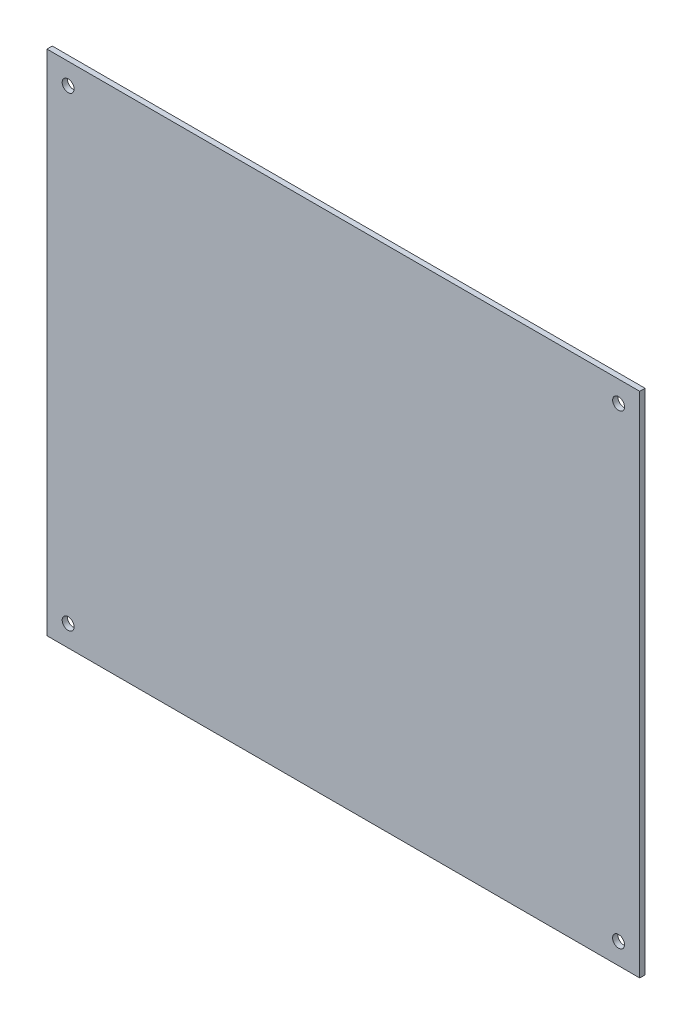
from build123d import *

# Parameters (mm, degrees)
SKETCH1_W               = 355.6
SKETCH1_H               = 304.8
BOSS_EXTRUDE1_DEPTH     = 3.175
F_1_4_CLEARANCE_HOLE1_D = 7.14248


with BuildPart() as part:
    # Sketch1 → Boss-Extrude1 (new body)
    with BuildSketch(Plane.XY):
        with Locations((177.8, -152.4)):
            Rectangle(SKETCH1_W, SKETCH1_H)
    extrude(amount=BOSS_EXTRUDE1_DEPTH)

    # 1/4 Clearance Hole1 (through all)
    with Locations(Plane.XY.offset(3.175)):
        with Locations((12.7, -12.7), (342.9, -12.7), (342.9, -292.1), (12.7, -292.1)):
            Hole(F_1_4_CLEARANCE_HOLE1_D / 2)


solid = part.part
